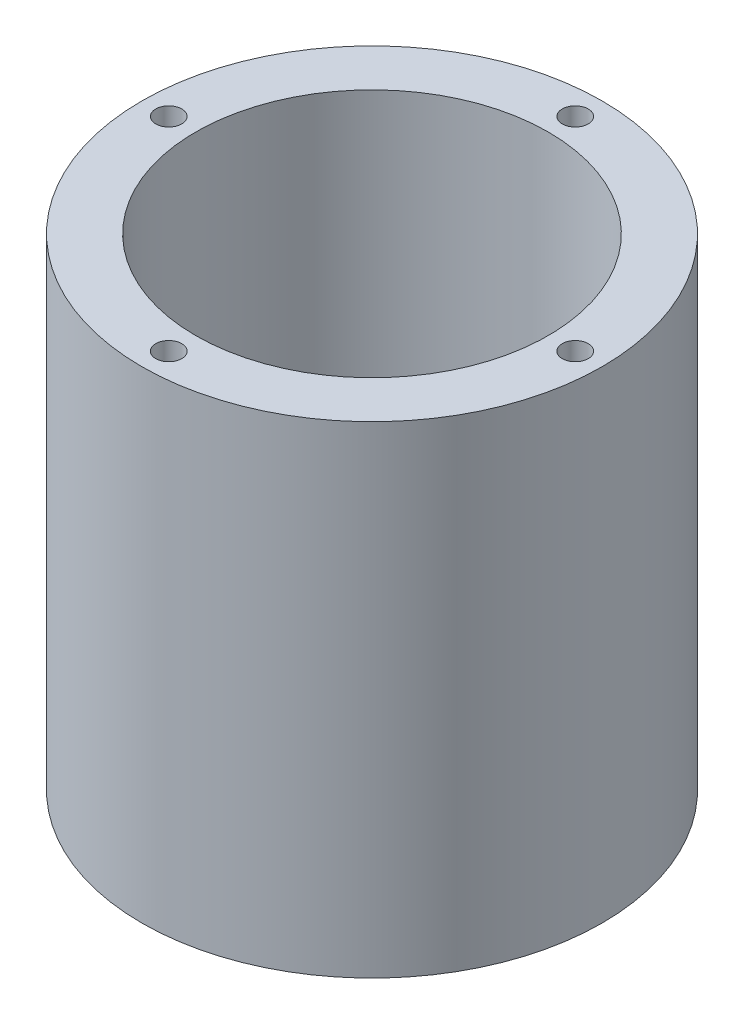
from build123d import *

# Parameters (mm, degrees)
SKETCH1_R           = 25.65
SKETCH1_R_2         = 19.65
SKETCH1_R_3         = 4
SKETCH1_R_4         = 0.95
BOSS_EXTRUDE1_DEPTH = 3.7
SKETCH2_R           = 25.65
SKETCH2_R_2         = 19.65
SKETCH2_R_3         = 4
SKETCH2_R_4         = 0.95
BOSS_EXTRUDE2_DEPTH = 50
SKETCH3_R           = 1.45
CUT_EXTRUDE1_DEPTH  = 15


with BuildPart() as part:
    # Sketch1 → Boss-Extrude1 (new body)
    # profile 1 of 2: a face of its own
    with BuildSketch(Plane(origin=(0, 0, 0), x_dir=(1, 0, 0), z_dir=(0, 1, 0))):
        with Locations(Location((0, 0, 0), (0, 0, 270))):
            Circle(SKETCH1_R)
        Circle(SKETCH1_R_2, mode=Mode.SUBTRACT)
    # profile 2 of 2: a face of its own
    with BuildSketch(Plane(origin=(0, 0, 0), x_dir=(1, 0, 0), z_dir=(0, 1, 0))):
        Circle(SKETCH1_R_2)
        with Locations(Location((0, 0, 0), (0, 0, 270))):
            Circle(SKETCH1_R_3, mode=Mode.SUBTRACT)
        with Locations(Location((16.6, 0, 0), (0, 0, 270))):
            Circle(SKETCH1_R_4, mode=Mode.SUBTRACT)
        with Locations(Location((0, -16.6, 0), (0, 0, 270))):
            Circle(SKETCH1_R_4, mode=Mode.SUBTRACT)
        with Locations(Location((-16.6, 0, 0), (0, 0, 270))):
            Circle(SKETCH1_R_4, mode=Mode.SUBTRACT)
        with Locations(Location((0, 16.6, 0), (0, 0, 270))):
            Circle(SKETCH1_R_4, mode=Mode.SUBTRACT)
    extrude(amount=BOSS_EXTRUDE1_DEPTH)

    # Sketch2 → Boss-Extrude2 (add)
    # profile 1 of 6: a face of its own
    with BuildSketch(Plane(origin=(0, 3.7, 0), x_dir=(1, 0, 0), z_dir=(0, 1, 0))):
        with Locations(Location((0, 0, 0), (0, 0, 270))):
            Circle(SKETCH2_R)
        with Locations(Location((0, 0, 0), (0, 0, 270))):
            Circle(SKETCH2_R_2, mode=Mode.SUBTRACT)
    # profile 2 of 6: a face of its own
    with BuildSketch(Plane(origin=(0, 3.7, 0), x_dir=(1, 0, 0), z_dir=(0, 1, 0))):
        with Locations(Location((0, 0, 0), (0, 0, 270))):
            Circle(SKETCH2_R_3)
    # profile 3 of 6: a face of its own
    with BuildSketch(Plane(origin=(0, 3.7, 0), x_dir=(1, 0, 0), z_dir=(0, 1, 0))):
        with Locations(Location((0, 16.6, 0), (0, 0, 270))):
            Circle(SKETCH2_R_4)
    # profile 4 of 6: a face of its own
    with BuildSketch(Plane(origin=(0, 3.7, 0), x_dir=(1, 0, 0), z_dir=(0, 1, 0))):
        with Locations(Location((-16.6, 0, 0), (0, 0, 270))):
            Circle(SKETCH2_R_4)
    # profile 5 of 6: a face of its own
    with BuildSketch(Plane(origin=(0, 3.7, 0), x_dir=(1, 0, 0), z_dir=(0, 1, 0))):
        with Locations(Location((0, -16.6, 0), (0, 0, 270))):
            Circle(SKETCH2_R_4)
    # profile 6 of 6: a face of its own
    with BuildSketch(Plane(origin=(0, 3.7, 0), x_dir=(1, 0, 0), z_dir=(0, 1, 0))):
        with Locations(Location((16.6, 0, 0), (0, 0, 270))):
            Circle(SKETCH2_R_4)
    extrude(amount=BOSS_EXTRUDE2_DEPTH)


with BuildPart() as boss_extrude2_kept_piece:
    # of the separate pieces the step leaves, the one the design keeps (boss_extrude2_pieces_kept)
    add(part.part.solids().sort_by_distance((0, 0, 25.65))[0])

    # Sketch3 → Cut-Extrude1 (cut)
    with BuildSketch(Plane(origin=(0, 53.7, 0), x_dir=(1, 0, 0), z_dir=(0, 1, 0))):
        with Locations(Location((22.65, 0, 0), (0, 0, 270))):
            Circle(SKETCH3_R)
        with Locations(Location((0, -22.65, 0), (0, 0, 270))):
            Circle(SKETCH3_R)
        with Locations(Location((-22.65, 0, 0), (0, 0, 270))):
            Circle(SKETCH3_R)
        with Locations(Location((0, 22.65, 0), (0, 0, 270))):
            Circle(SKETCH3_R)
    extrude(amount=-CUT_EXTRUDE1_DEPTH, mode=Mode.SUBTRACT)


solid = boss_extrude2_kept_piece.part
